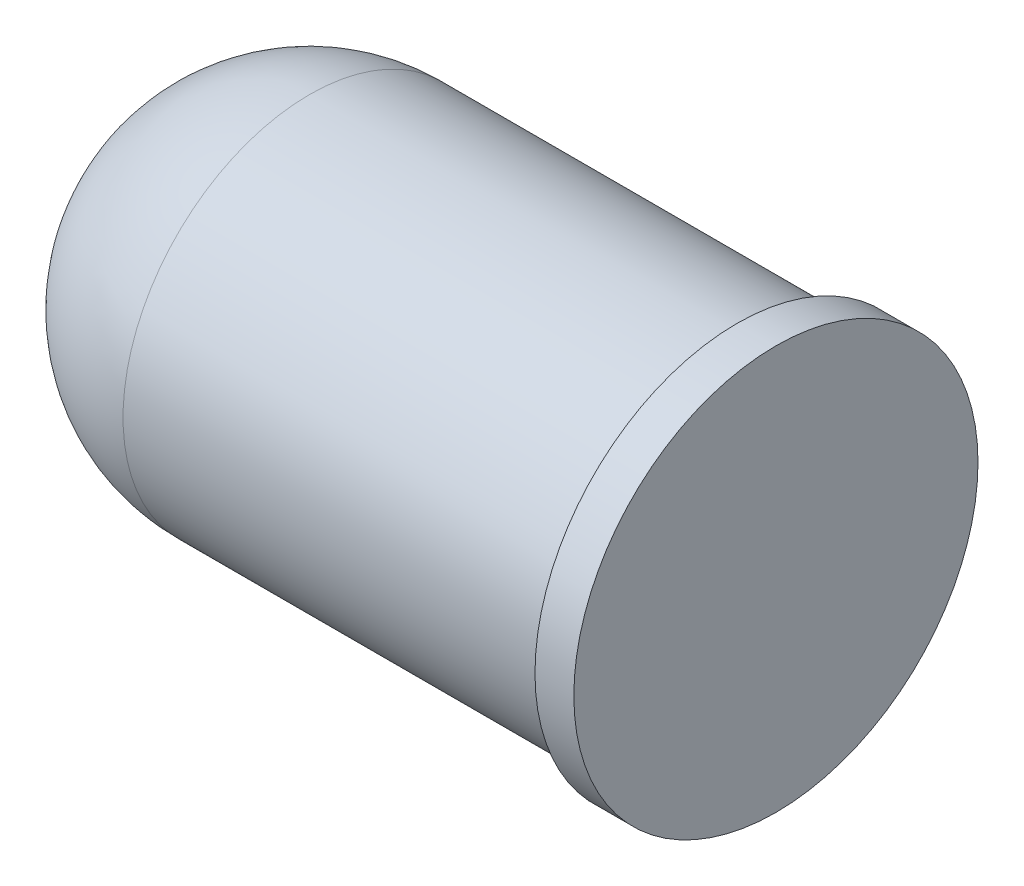
from build123d import *


with BuildPart() as part:
    # Esquisse1 → Révolution1 (revolve)
    with BuildSketch(Plane.XY, mode=Mode.PRIVATE) as r_volution1_sk:
        with BuildLine():
            Line((0, 0), (-8.4, 0))
            ThreePointArc((-8.4, 0), (-7.697056275, 1.697056275), (-6, 2.4))
            Line((-6, 2.4), (-0.5, 2.4))
            Line((-0.5, 2.4), (-0.5, 2.6))
            Line((-0.5, 2.6), (0, 2.6))
            Line((0, 2.6), (0, 0))
        make_face()
    revolve(r_volution1_sk.sketch.rotate(Axis((-6.776805371, 0, 0), (1, 0, 0)), 180), axis=Axis((-6.776805371, 0, 0), (1, 0, 0)))


solid = part.part
